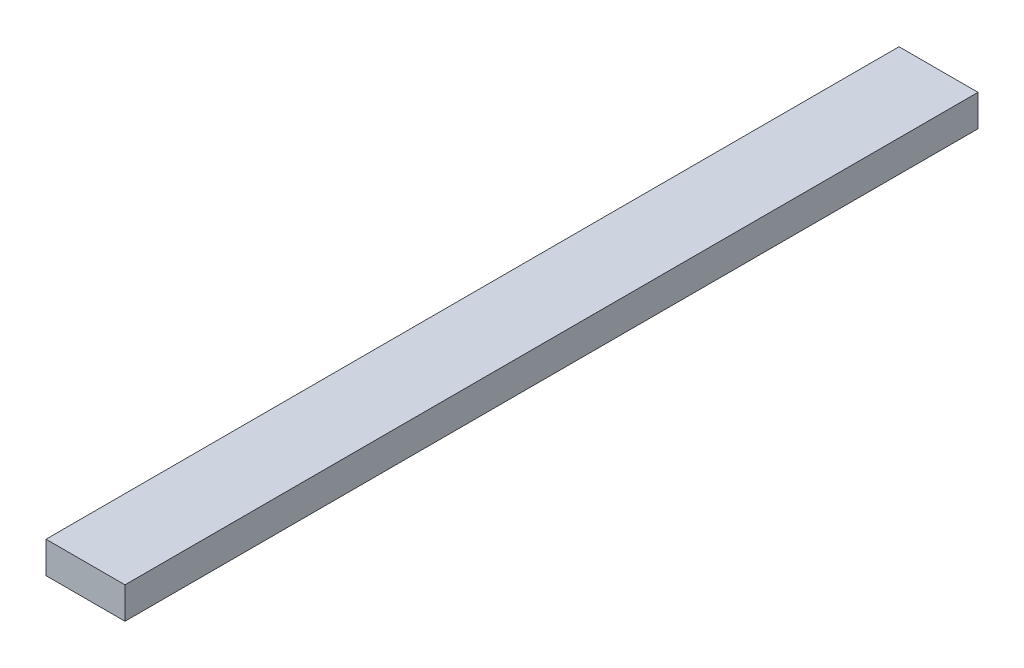
from build123d import *

# Parameters (mm, degrees)
SKETCH1_W           = 25
SKETCH1_H           = 270
BOSS_EXTRUDE1_DEPTH = 10


with BuildPart() as part:
    # Sketch1 → Boss-Extrude1 (new body)
    with BuildSketch(Plane(origin=(0, 0, 0), x_dir=(1, 0, 0), z_dir=(0, 1, 0))):
        with Locations((12.5, 135)):
            Rectangle(SKETCH1_W, SKETCH1_H)
    extrude(amount=BOSS_EXTRUDE1_DEPTH)


solid = part.part
